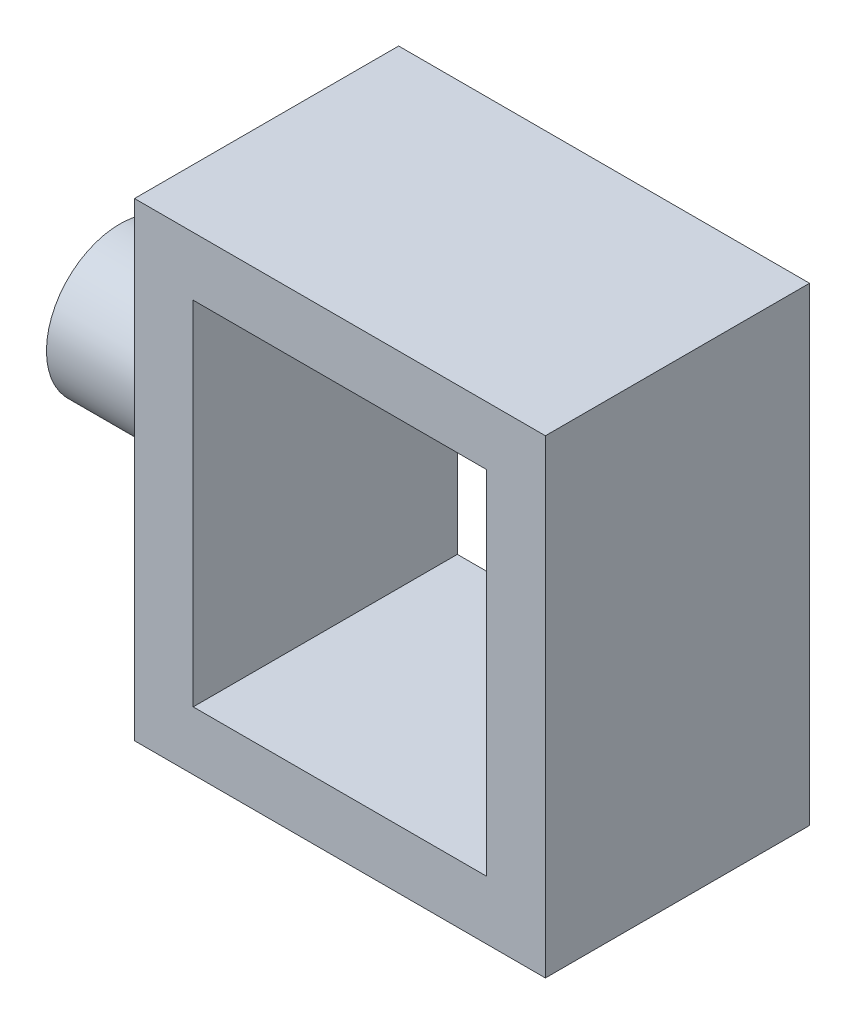
from build123d import *

# Parameters (mm, degrees)
SKETCH1_W           = 14
SKETCH1_H           = 16
SKETCH1_W_2         = 10
SKETCH1_H_2         = 12
BOSS_EXTRUDE1_DEPTH = 9
SKETCH2_R           = 2.5
SKETCH2_R_2         = 0.5
BOSS_EXTRUDE2_DEPTH = 5


with BuildPart() as part:
    # Sketch1 → Boss-Extrude1 (new body)
    with BuildSketch(Plane.XY):
        with Locations((-7, 8)):
            Rectangle(SKETCH1_W, SKETCH1_H)
        with Locations((-7, 8)):
            Rectangle(SKETCH1_W_2, SKETCH1_H_2, mode=Mode.SUBTRACT)
    extrude(amount=BOSS_EXTRUDE1_DEPTH)

    # Sketch2 → Boss-Extrude2 (add)
    with BuildSketch(Plane.ZY.offset(14)):
        with Locations((4.5, 8)):
            Circle(SKETCH2_R)
        with Locations((4.5, 8)):
            Circle(SKETCH2_R_2, mode=Mode.SUBTRACT)
    extrude(amount=BOSS_EXTRUDE2_DEPTH)


solid = part.part
